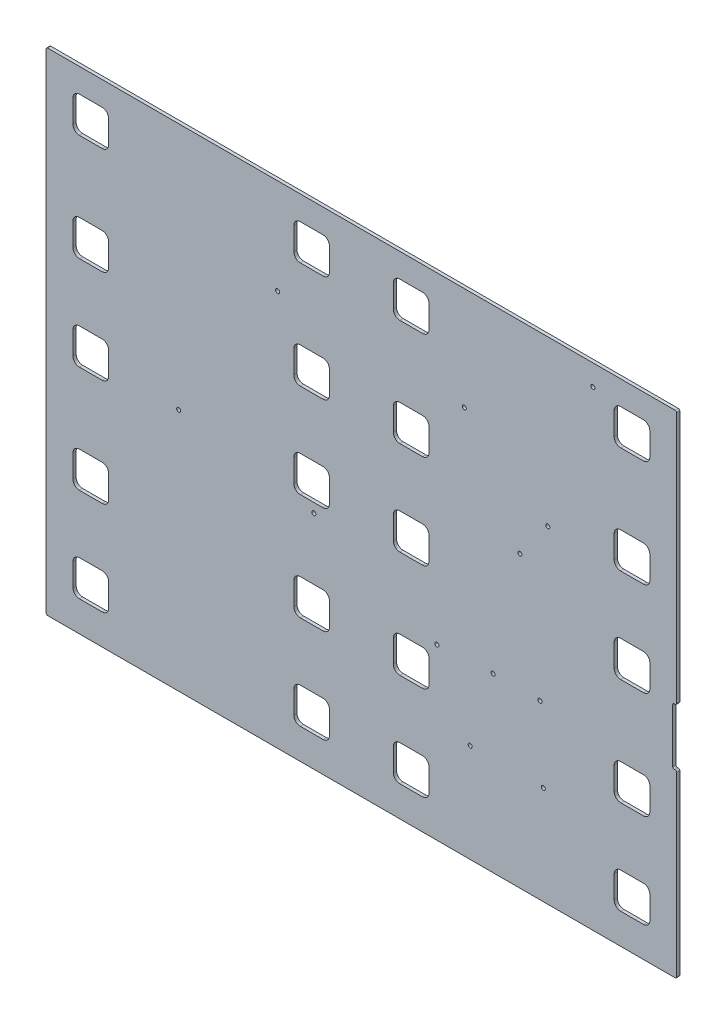
from build123d import *

# Parameters (mm, degrees)
BOSS_EXTRUDE2_DEPTH  = 3.175
CUT_EXTRUDE6_DEPTH   = 570.66376491
LPATTERN2_COUNT      = 2
LPATTERN2_PITCH      = 217.5764
MIRROR1_COPY_1_DEPTH = 570.66376491
SKETCH11_R           = 1.9939
CUT_EXTRUDE7_DEPTH   = 570.66376491
CUT_EXTRUDE8_DEPTH   = 570.66376491
FILLET1_R            = 1.5875


with BuildPart() as part:
    # Sketch9 → Boss-Extrude2 (new body)
    with BuildSketch(Plane.XY):
        Polygon((476.883139425, 172.802708817), (-144.375457148, 172.737459045), (-144.32459706, -311.513538284), (476.933999514, -311.448288512), align=None)
    extrude(amount=BOSS_EXTRUDE2_DEPTH)

    # Sketch10 → Cut-Extrude6 (cut, through all)
    with BuildSketch(Plane.XY.offset(3.175)):
        with BuildLine():
            Line((-82.787744514, 120.254927212), (-82.79010009, 142.682927088))
            ThreePointArc((-82.79010009, 142.682927088), (-84.65044361, 147.172859784), (-89.140766985, 149.032260123))
            Line((-89.140766985, 149.032260123), (-111.568766861, 149.029904547))
            ThreePointArc((-111.568766861, 149.029904547), (-116.058699558, 147.169561027), (-117.918099896, 142.679237652))
            Line((-117.918099896, 142.679237652), (-117.91574432, 120.251237775))
            ThreePointArc((-117.91574432, 120.251237775), (-116.0554008, 115.761305079), (-111.565077425, 113.901904741))
            Line((-111.565077425, 113.901904741), (-89.137077549, 113.904260317))
            ThreePointArc((-89.137077549, 113.904260317), (-84.647144852, 115.764603837), (-82.787744514, 120.254927212))
        make_face()
        with BuildLine():
            Line((-117.907058342, 37.548638232), (-117.904702766, 15.120638356))
            ThreePointArc((-117.904702766, 15.120638356), (-116.044359246, 10.630705659), (-111.554035871, 8.771305321))
            Line((-111.554035871, 8.771305321), (-89.126035994, 8.773660897))
            ThreePointArc((-89.126035994, 8.773660897), (-84.636103298, 10.634004417), (-82.77670296, 15.124327792))
            Line((-82.77670296, 15.124327792), (-82.779058536, 37.552327668))
            ThreePointArc((-82.779058536, 37.552327668), (-84.639402056, 42.042260365), (-89.129725431, 43.901660703))
            Line((-89.129725431, 43.901660703), (-111.557725307, 43.899305127))
            ThreePointArc((-111.557725307, 43.899305127), (-116.047658003, 42.038961607), (-117.907058342, 37.548638232))
        make_face()
        with BuildLine():
            Line((-82.766978979, -77.458671698), (-82.769334555, -55.030671822))
            ThreePointArc((-82.769334555, -55.030671822), (-84.629678075, -50.540739125), (-89.12000145, -48.681338787))
            Line((-89.12000145, -48.681338787), (-111.548001326, -48.683694363))
            ThreePointArc((-111.548001326, -48.683694363), (-116.037934023, -50.544037883), (-117.897334361, -55.034361258))
            Line((-117.897334361, -55.034361258), (-117.894978785, -77.462361134))
            ThreePointArc((-117.894978785, -77.462361134), (-116.034635265, -81.952293831), (-111.54431189, -83.811694169))
            Line((-111.54431189, -83.811694169), (-89.116312014, -83.809338593))
            ThreePointArc((-89.116312014, -83.809338593), (-84.626379317, -81.948995073), (-82.766978979, -77.458671698))
        make_face()
        with BuildLine():
            Line((-89.108959896, -153.811938206), (-111.536959772, -153.814293782))
            ThreePointArc((-111.536959772, -153.814293782), (-116.026892468, -155.674637302), (-117.886292807, -160.164960677))
            Line((-117.886292807, -160.164960677), (-117.883937231, -182.592960554))
            ThreePointArc((-117.883937231, -182.592960554), (-116.023593711, -187.08289325), (-111.533270336, -188.942293589))
            Line((-111.533270336, -188.942293589), (-89.105270459, -188.939938013))
            ThreePointArc((-89.105270459, -188.939938013), (-84.615337763, -187.079594493), (-82.755937424, -182.589271117))
            Line((-82.755937424, -182.589271117), (-82.758293, -160.161271241))
            ThreePointArc((-82.758293, -160.161271241), (-84.61863652, -155.671338545), (-89.108959896, -153.811938206))
        make_face()
        with BuildLine():
            Line((-117.876568826, -252.747960167), (-117.87421325, -275.175960044))
            ThreePointArc((-117.87421325, -275.175960044), (-116.01386973, -279.66589274), (-111.523546355, -281.525293079))
            Line((-111.523546355, -281.525293079), (-89.095546479, -281.522937502))
            ThreePointArc((-89.095546479, -281.522937502), (-84.605613782, -279.662593982), (-82.746213444, -275.172270607))
            Line((-82.746213444, -275.172270607), (-82.74856902, -252.744270731))
            ThreePointArc((-82.74856902, -252.744270731), (-84.60891254, -248.254338035), (-89.099235915, -246.394937696))
            Line((-89.099235915, -246.394937696), (-111.527235791, -246.397293272))
            ThreePointArc((-111.527235791, -246.397293272), (-116.017168488, -248.257636792), (-117.876568826, -252.747960167))
        make_face()
    cut_extrude6 = extrude(amount=-CUT_EXTRUDE6_DEPTH, mode=Mode.SUBTRACT)

    # LPattern2: Cut-Extrude6 ×2
    with Locations(*[Vector(0.9999999944845218, 0.00010502836011308976, 0) * (i * LPATTERN2_PITCH) for i in range(1, LPATTERN2_COUNT)]):
        add(cut_extrude6, mode=Mode.SUBTRACT)

    # Mirror1: Cut-Extrude6 across plane
    add(cut_extrude6.mirror(Plane(origin=(166.271985063, 0.017463274, 0), x_dir=(0, 0, 1), z_dir=(-0.9999999944845219, -0.00010502836011320445, 0))), mode=Mode.SUBTRACT)

    # Mirror1 copy 1 sketch → Mirror1 copy 1 (cut, through all)
    with BuildSketch(Plane(origin=(114.967571327, 0.012074856, 3.175), x_dir=(-0.9999999779380877, -0.00021005671906784565, 0), z_dir=(0, 0, 1))):
        with BuildLine():
            Line((-82.787744514, -120.254927212), (-82.79010009, -142.682927088))
            ThreePointArc((-82.79010009, -142.682927088), (-84.65044361, -147.172859784), (-89.140766985, -149.032260123))
            Line((-89.140766985, -149.032260123), (-111.568766861, -149.029904547))
            ThreePointArc((-111.568766861, -149.029904547), (-116.058699558, -147.169561027), (-117.918099896, -142.679237652))
            Line((-117.918099896, -142.679237652), (-117.91574432, -120.251237775))
            ThreePointArc((-117.91574432, -120.251237775), (-116.0554008, -115.761305079), (-111.565077425, -113.901904741))
            Line((-111.565077425, -113.901904741), (-89.137077549, -113.904260317))
            ThreePointArc((-89.137077549, -113.904260317), (-84.647144852, -115.764603837), (-82.787744514, -120.254927212))
        make_face()
        with BuildLine():
            Line((-117.907058342, -37.548638232), (-117.904702766, -15.120638356))
            ThreePointArc((-117.904702766, -15.120638356), (-116.044359246, -10.630705659), (-111.554035871, -8.771305321))
            Line((-111.554035871, -8.771305321), (-89.126035994, -8.773660897))
            ThreePointArc((-89.126035994, -8.773660897), (-84.636103298, -10.634004417), (-82.77670296, -15.124327792))
            Line((-82.77670296, -15.124327792), (-82.779058536, -37.552327668))
            ThreePointArc((-82.779058536, -37.552327668), (-84.639402056, -42.042260365), (-89.129725431, -43.901660703))
            Line((-89.129725431, -43.901660703), (-111.557725307, -43.899305127))
            ThreePointArc((-111.557725307, -43.899305127), (-116.047658003, -42.038961607), (-117.907058342, -37.548638232))
        make_face()
        with BuildLine():
            Line((-82.766978979, 77.458671698), (-82.769334555, 55.030671822))
            ThreePointArc((-82.769334555, 55.030671822), (-84.629678075, 50.540739125), (-89.12000145, 48.681338787))
            Line((-89.12000145, 48.681338787), (-111.548001326, 48.683694363))
            ThreePointArc((-111.548001326, 48.683694363), (-116.037934023, 50.544037883), (-117.897334361, 55.034361258))
            Line((-117.897334361, 55.034361258), (-117.894978785, 77.462361134))
            ThreePointArc((-117.894978785, 77.462361134), (-116.034635265, 81.952293831), (-111.54431189, 83.811694169))
            Line((-111.54431189, 83.811694169), (-89.116312014, 83.809338593))
            ThreePointArc((-89.116312014, 83.809338593), (-84.626379317, 81.948995073), (-82.766978979, 77.458671698))
        make_face()
        with BuildLine():
            Line((-89.108959896, 153.811938206), (-111.536959772, 153.814293782))
            ThreePointArc((-111.536959772, 153.814293782), (-116.026892468, 155.674637302), (-117.886292807, 160.164960677))
            Line((-117.886292807, 160.164960677), (-117.883937231, 182.592960554))
            ThreePointArc((-117.883937231, 182.592960554), (-116.023593711, 187.08289325), (-111.533270336, 188.942293589))
            Line((-111.533270336, 188.942293589), (-89.105270459, 188.939938013))
            ThreePointArc((-89.105270459, 188.939938013), (-84.615337763, 187.079594493), (-82.755937424, 182.589271117))
            Line((-82.755937424, 182.589271117), (-82.758293, 160.161271241))
            ThreePointArc((-82.758293, 160.161271241), (-84.61863652, 155.671338545), (-89.108959896, 153.811938206))
        make_face()
        with BuildLine():
            Line((-117.876568826, 252.747960167), (-117.87421325, 275.175960044))
            ThreePointArc((-117.87421325, 275.175960044), (-116.01386973, 279.66589274), (-111.523546355, 281.525293079))
            Line((-111.523546355, 281.525293079), (-89.095546479, 281.522937502))
            ThreePointArc((-89.095546479, 281.522937502), (-84.605613782, 279.662593982), (-82.746213444, 275.172270607))
            Line((-82.746213444, 275.172270607), (-82.74856902, 252.744270731))
            ThreePointArc((-82.74856902, 252.744270731), (-84.60891254, 248.254338035), (-89.099235915, 246.394937696))
            Line((-89.099235915, 246.394937696), (-111.527235791, 246.397293272))
            ThreePointArc((-111.527235791, 246.397293272), (-116.017168488, 248.257636792), (-117.876568826, 252.747960167))
        make_face()
    extrude(amount=-MIRROR1_COPY_1_DEPTH, mode=Mode.SUBTRACT)

    # Sketch11 → Cut-Extrude7 (cut, through all)
    with BuildSketch(Plane.XY.offset(3.175)):
        with Locations((296.038660132, -141.604786716)):
            Circle(SKETCH11_R)
        with Locations((394.335307404, 152.15653884)):
            Circle(SKETCH11_R)
        with Locations((267.691292818, 71.358237181)):
            Circle(SKETCH11_R)
        with Locations((83.796928701, 78.623923098)):
            Circle(SKETCH11_R)
        with Locations((-13.737316507, -71.386321592)):
            Circle(SKETCH11_R)
        with Locations((349.923624735, 11.074864309)):
            Circle(SKETCH11_R)
        with Locations((322.427523958, -26.052005233)):
            Circle(SKETCH11_R)
        with Locations((342.238659877, -141.599934406)):
            Circle(SKETCH11_R)
        with Locations((345.511300672, -214.349591087)):
            Circle(SKETCH11_R)
        with Locations((119.406061758, -93.07123788)):
            Circle(SKETCH11_R)
        with Locations((240.696463223, -144.493499232)):
            Circle(SKETCH11_R)
        with Locations((273.511301069, -214.357153129)):
            Circle(SKETCH11_R)
    extrude(amount=-CUT_EXTRUDE7_DEPTH, mode=Mode.SUBTRACT)

    # Sketch12 → Cut-Extrude8 (cut, through all)
    with BuildSketch(Plane.XY.offset(3.175)):
        Polygon((476.909497019, -78.154204664), (472.960931489, -78.154204664), (472.960931489, -106.094205498), (472.960931489, -134.034204664), (476.915366003, -134.034204664), align=None)
    extrude(amount=-CUT_EXTRUDE8_DEPTH, mode=Mode.SUBTRACT)

    # Fillet1
    fillet1_edges = [part.edges().sort_by_distance(p)[0] for p in [
        (472.960931489, -134.034204664, 1.5875),
        (472.960931489, -78.154204664, 1.5875),
        (476.909497019, -78.154204664, 1.5875),
        (476.915366003, -134.034204664, 1.5875),
        (-144.32459706, -311.513538284, 1.5875),
        (-144.375457148, 172.737459045, 1.5875),
        (476.883139425, 172.802708817, 1.5875),
        (476.933999514, -311.448288512, 1.5875),
    ]]
    fillet(fillet1_edges, radius=FILLET1_R)


solid = part.part
